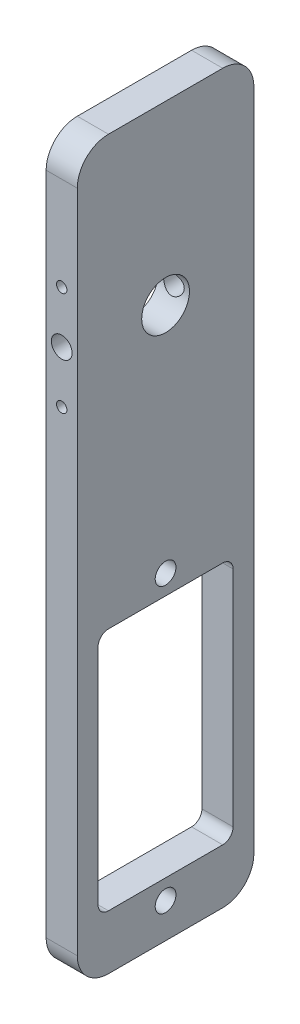
from build123d import *

# Parameters (mm, degrees)
SKETCH1_R           = 1
SKETCH1_R_2         = 2.3
BOSS_EXTRUDE1_DEPTH = 3
SKETCH2_R           = 0.5
SKETCH2_R_2         = 1
CUT_EXTRUDE1_DEPTH  = 73.097156671


with BuildPart() as part:
    # Sketch1 → Boss-Extrude1 (new body)
    with BuildSketch(Plane(origin=(0, 0, 0), x_dir=(0, 0, -1), z_dir=(1, 0, 0))):
        with BuildLine():
            Line((-5.5, 0), (5.5, 0))
            ThreePointArc((5.5, 0), (7.621320344, 0.878679656), (8.5, 3))
            Line((8.5, 3), (8.5, 67))
            ThreePointArc((8.5, 67), (7.621320344, 69.121320344), (5.5, 70))
            Line((5.5, 70), (-5.5, 70))
            ThreePointArc((-5.5, 70), (-7.621320344, 69.121320344), (-8.5, 67))
            Line((-8.5, 67), (-8.5, 3))
            ThreePointArc((-8.5, 3), (-7.621320344, 0.878679656), (-5.5, 0))
        make_face()
        with Locations((0, 3.35)):
            Circle(SKETCH1_R, mode=Mode.SUBTRACT)
        with Locations(Location((0, 30.65, 0), (0, 0, 180))):
            Circle(SKETCH1_R, mode=Mode.SUBTRACT)
        with Locations(Location((0, 53, 0), (0, 0, 180))):
            Circle(SKETCH1_R_2, mode=Mode.SUBTRACT)
        with BuildLine():
            Line((-6.5, 27.75), (-6.5, 6.25))
            ThreePointArc((-6.5, 6.25), (-6.207106781, 5.542893219), (-5.5, 5.25))
            Line((-5.5, 5.25), (5.5, 5.25))
            ThreePointArc((5.5, 5.25), (6.207106781, 5.542893219), (6.5, 6.25))
            Line((6.5, 6.25), (6.5, 27.75))
            ThreePointArc((6.5, 27.75), (6.207106781, 28.457106781), (5.5, 28.75))
            Line((5.5, 28.75), (-5.5, 28.75))
            ThreePointArc((-5.5, 28.75), (-6.207106781, 28.457106781), (-6.5, 27.75))
        make_face(mode=Mode.SUBTRACT)
    extrude(amount=BOSS_EXTRUDE1_DEPTH)

    # Sketch2 → Cut-Extrude1 (cut, through all)
    with BuildSketch(Plane(origin=(0, 0, -8.5), x_dir=(-1, 0, 0), z_dir=(0, 0, -1))):
        with Locations((-1.5, 58)):
            Circle(SKETCH2_R)
        with Locations(Location((-1.5, 48, 0), (0, 0, 180))):
            Circle(SKETCH2_R)
        with Locations((-1.5, 53)):
            Circle(SKETCH2_R_2)
    extrude(amount=-CUT_EXTRUDE1_DEPTH, mode=Mode.SUBTRACT)


solid = part.part
